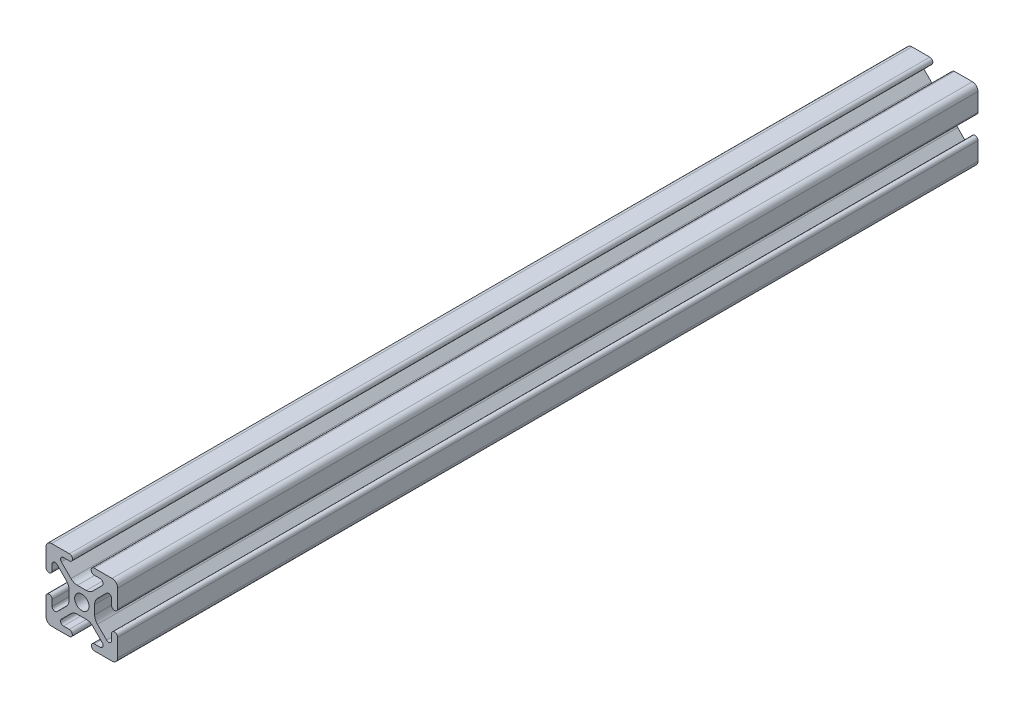
from build123d import *

# Parameters (mm, degrees)
SKETCH1_R      = 2.5
EXTRUDE1_DEPTH = 300


with BuildPart() as part:
    # Sketch1 → Extrude1 (new body)
    with BuildSketch(Plane.XY):
        with BuildLine():
            Line((-8.636346088, 7.111588351), (-5.432204773, 3.912143135))
            ThreePointArc((-5.432204773, 3.912143135), (-4.708985779, 2.831057106), (-4.455, 1.555406707))
            Line((-4.455, 1.555406707), (-4.455, -1.555406707))
            ThreePointArc((-4.455, -1.555406707), (-4.708985779, -2.831057106), (-5.432204773, -3.912143135))
            Line((-5.432204773, -3.912143135), (-8.636346088, -7.111588351))
            ThreePointArc((-8.636346088, -7.111588351), (-9.736852394, -7.329863489), (-10.36, -6.396886949))
            Line((-10.36, -6.396886949), (-10.36, -4.32))
            ThreePointArc((-10.36, -4.32), (-11.43, -3.25), (-12.5, -4.32))
            Line((-12.5, -4.32), (-12.5, -8.651801989))
            Line((-12.5, -8.651801989), (-12.5, -10.537068835))
            ThreePointArc((-12.5, -10.537068835), (-11.925070773, -11.925070773), (-10.537068835, -12.5))
            Line((-10.537068835, -12.5), (-8.441567612, -12.5))
            Line((-8.441567612, -12.5), (-4.387856959, -12.5))
            ThreePointArc((-4.387856959, -12.5), (-3.317856959, -11.43), (-4.387856959, -10.36))
            Line((-4.387856959, -10.36), (-6.42, -10.36))
            ThreePointArc((-6.42, -10.36), (-7.35325999, -9.736168088), (-7.133653912, -8.635298598))
            Line((-7.133653912, -8.635298598), (-3.795290766, -5.301828272))
            ThreePointArc((-3.795290766, -5.301828272), (-2.76743922, -4.61585726), (-1.555406707, -4.375))
            Line((-1.555406707, -4.375), (1.555406707, -4.375))
            ThreePointArc((1.555406707, -4.375), (2.76743922, -4.61585726), (3.795290766, -5.301828272))
            Line((3.795290766, -5.301828272), (7.133653912, -8.635298598))
            ThreePointArc((7.133653912, -8.635298598), (7.35325999, -9.736168088), (6.42, -10.36))
            Line((6.42, -10.36), (4.387856959, -10.36))
            ThreePointArc((4.387856959, -10.36), (3.317856959, -11.43), (4.387856959, -12.5))
            Line((4.387856959, -12.5), (8.441567612, -12.5))
            Line((8.441567612, -12.5), (10.537068835, -12.5))
            ThreePointArc((10.537068835, -12.5), (11.925070773, -11.925070773), (12.5, -10.537068835))
            Line((12.5, -10.537068835), (12.5, -8.651801989))
            Line((12.5, -8.651801989), (12.5, -4.32))
            ThreePointArc((12.5, -4.32), (11.43, -3.25), (10.36, -4.32))
            Line((10.36, -4.32), (10.36, -6.396886949))
            ThreePointArc((10.36, -6.396886949), (9.736852394, -7.329863489), (8.636346088, -7.111588351))
            Line((8.636346088, -7.111588351), (5.432204773, -3.912143135))
            ThreePointArc((5.432204773, -3.912143135), (4.708985779, -2.831057106), (4.455, -1.555406707))
            Line((4.455, -1.555406707), (4.455, 1.555406707))
            ThreePointArc((4.455, 1.555406707), (4.708985779, 2.831057106), (5.432204773, 3.912143135))
            Line((5.432204773, 3.912143135), (8.636346088, 7.111588351))
            ThreePointArc((8.636346088, 7.111588351), (9.736852394, 7.329863489), (10.36, 6.396886949))
            Line((10.36, 6.396886949), (10.36, 4.32))
            ThreePointArc((10.36, 4.32), (11.43, 3.25), (12.5, 4.32))
            Line((12.5, 4.32), (12.5, 7.99129648))
            Line((12.5, 7.99129648), (12.5, 10.537068835))
            ThreePointArc((12.5, 10.537068835), (11.925070773, 11.925070773), (10.537068835, 12.5))
            Line((10.537068835, 12.5), (4.32, 12.5))
            ThreePointArc((4.32, 12.5), (3.25, 11.43), (4.32, 10.36))
            Line((4.32, 10.36), (6.42, 10.36))
            ThreePointArc((6.42, 10.36), (7.35325999, 9.736168088), (7.133653912, 8.635298598))
            Line((7.133653912, 8.635298598), (3.795290766, 5.301828272))
            ThreePointArc((3.795290766, 5.301828272), (2.76743922, 4.61585726), (1.555406707, 4.375))
            Line((1.555406707, 4.375), (-1.555406707, 4.375))
            ThreePointArc((-1.555406707, 4.375), (-2.76743922, 4.61585726), (-3.795290766, 5.301828272))
            Line((-3.795290766, 5.301828272), (-7.133653912, 8.635298598))
            ThreePointArc((-7.133653912, 8.635298598), (-7.35325999, 9.736168088), (-6.42, 10.36))
            Line((-6.42, 10.36), (-4.32, 10.36))
            ThreePointArc((-4.32, 10.36), (-3.25, 11.43), (-4.32, 12.5))
            Line((-4.32, 12.5), (-10.537068835, 12.5))
            ThreePointArc((-10.537068835, 12.5), (-11.925070773, 11.925070773), (-12.5, 10.537068835))
            Line((-12.5, 10.537068835), (-12.5, 7.99129648))
            Line((-12.5, 7.99129648), (-12.5, 4.32))
            ThreePointArc((-12.5, 4.32), (-11.43, 3.25), (-10.36, 4.32))
            Line((-10.36, 4.32), (-10.36, 6.396886949))
            ThreePointArc((-10.36, 6.396886949), (-9.736852394, 7.329863489), (-8.636346088, 7.111588351))
        make_face()
        Circle(SKETCH1_R, mode=Mode.SUBTRACT)
    extrude(amount=-EXTRUDE1_DEPTH)


solid = part.part
